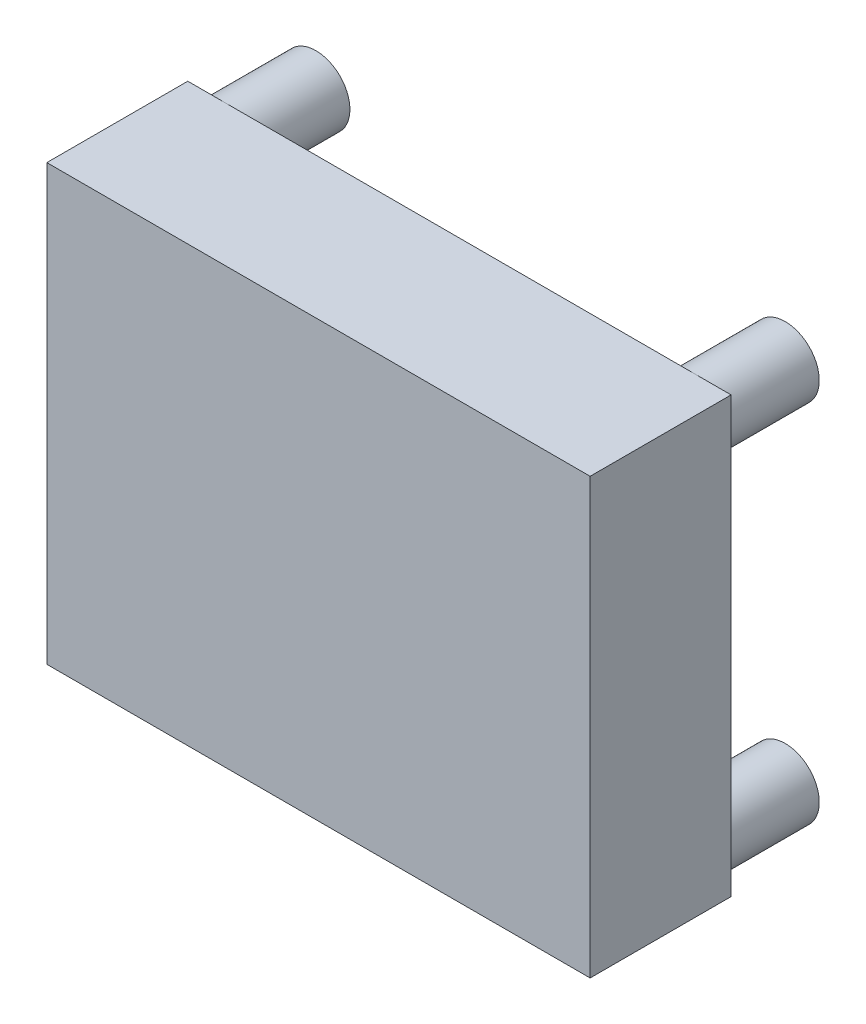
from build123d import *

# Parameters (mm, degrees)
SKETCH1_W           = 57.0738
SKETCH1_H           = 45.6438
BOSS_EXTRUDE1_DEPTH = 14.8082
SKETCH2_R           = 3.5687
BOSS_EXTRUDE2_DEPTH = 9.5758
SKETCH3_R           = 1.3462
CUT_EXTRUDE1_DEPTH  = 8.89


with BuildPart() as part:
    # Sketch1 → Boss-Extrude1 (new body)
    with BuildSketch(Plane.XY):
        with Locations((28.5369, 22.8219)):
            Rectangle(SKETCH1_W, SKETCH1_H)
    extrude(amount=BOSS_EXTRUDE1_DEPTH)

    # Sketch2 → Boss-Extrude2 (add)
    with BuildSketch(Plane(origin=(0, 0, 0), x_dir=(-1, 0, 0), z_dir=(0, 0, -1))):
        with Locations((-3.8862, 42.0116)):
            Circle(SKETCH2_R)
        with Locations((-3.8862, 3.6322)):
            Circle(SKETCH2_R)
        with Locations((-53.1876, 3.6322)):
            Circle(SKETCH2_R)
        with Locations((-53.1876, 42.0116)):
            Circle(SKETCH2_R)
    extrude(amount=BOSS_EXTRUDE2_DEPTH)

    # Sketch3 → Cut-Extrude1 (cut)
    with BuildSketch(Plane(origin=(0, 0, -9.5758), x_dir=(-1, 0, 0), z_dir=(0, 0, -1))):
        with Locations((-3.8862, 3.6322)):
            Circle(SKETCH3_R)
        with Locations((-53.1876, 3.6322)):
            Circle(SKETCH3_R)
        with Locations((-53.1876, 42.0116)):
            Circle(SKETCH3_R)
        with Locations((-3.8862, 42.0116)):
            Circle(SKETCH3_R)
    extrude(amount=-CUT_EXTRUDE1_DEPTH, mode=Mode.SUBTRACT)


solid = part.part
